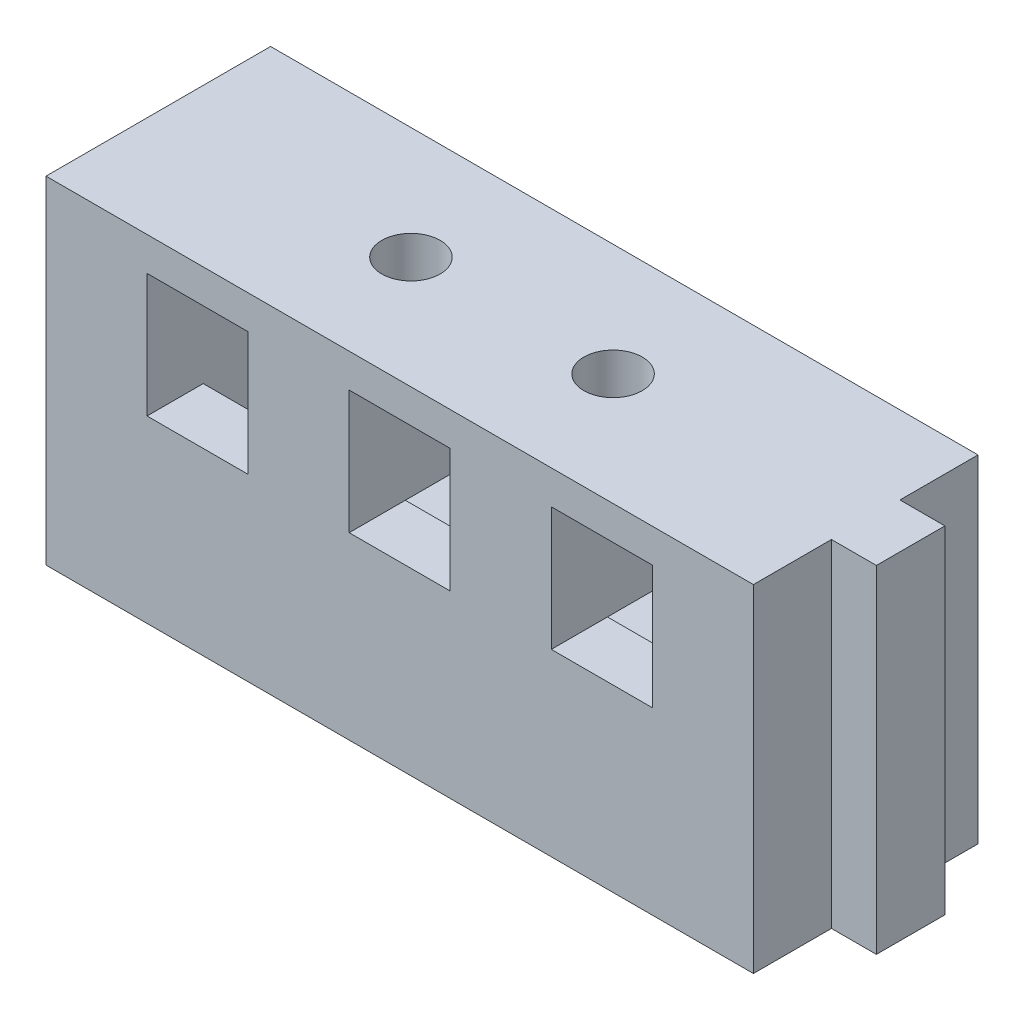
from build123d import *

# Parameters (mm, degrees)
SKETCH_1_W          = 63
SKETCH_1_H          = 30
SKETCH_1_W_2        = 9
SKETCH_1_H_2        = 11
EXTRUDE_2_DEPTH     = 20
SKETCH_2_W          = 9
SKETCH_2_H          = 11
CUT_EXTRUDE_1_DEPTH = 15
SKETCH_3_W          = 9
SKETCH_3_H          = 11
EXTRUDE_3_DEPTH     = 15
CUT_EXTRUDE_2_DEPTH = 100
SKETCH_6_R          = 5
CUT_EXTRUDE_3_DEPTH = 2
SKETCH_7_W          = 3.05
SKETCH_7_H          = 15
EXTRUDE_4_DEPTH     = 4


with BuildPart() as part:
    # 草图1 → 凸台-拉伸2 (new body)
    with BuildSketch(Plane.XY):
        with Locations((18.5, 15)):
            Rectangle(SKETCH_1_W, SKETCH_1_H)
        with Locations((18.5, 21.5)):
            Rectangle(SKETCH_1_W_2, SKETCH_1_H_2, mode=Mode.SUBTRACT)
        with Locations((36.5, 21.5)):
            Rectangle(SKETCH_1_W_2, SKETCH_1_H_2, mode=Mode.SUBTRACT)
        with Locations((0.5, 21.5)):
            Rectangle(SKETCH_1_W_2, SKETCH_1_H_2, mode=Mode.SUBTRACT)
    extrude(amount=EXTRUDE_2_DEPTH)

    # 草图2 → 切除-拉伸1 (cut)
    with BuildSketch(Plane(origin=(0, 0, 0), x_dir=(-1, 0, 0), z_dir=(0, 0, -1))):
        Polygon((-50, 16), (-50, 5), (4, 5), (4, 16), (-5, 16), (-14, 16), (-23, 16), (-32, 16), (-41, 16), align=None)
        with Locations((8.5, 10.5)):
            Rectangle(SKETCH_2_W, SKETCH_2_H)
    extrude(amount=-CUT_EXTRUDE_1_DEPTH, mode=Mode.SUBTRACT)

    # 草图3 → 凸台-拉伸3 (add)
    with BuildSketch(Plane(origin=(0, 0, 0), x_dir=(-1, 0, 0), z_dir=(0, 0, -1))):
        with Locations((-45.5, 10.5)):
            Rectangle(SKETCH_3_W, SKETCH_3_H)
        with Locations((8.5, 10.5)):
            Rectangle(SKETCH_3_W, SKETCH_3_H)
    extrude(amount=-EXTRUDE_3_DEPTH)

    # 草图5 → 切除-拉伸2 (cut)
    with BuildSketch(Plane.XZ):
        with BuildLine():
            ThreePointArc((27.5, 12.6), (25.661522369, 11.838477631), (24.9, 10))
            Line((24.9, 10), (27.5, 10))
            Line((27.5, 10), (27.5, 12.6))
        make_face()
        with BuildLine():
            Line((27.5, 10), (24.9, 10))
            ThreePointArc((24.9, 10), (25.661522369, 8.161522369), (27.5, 7.4))
            Line((27.5, 7.4), (27.5, 10))
        make_face()
        with BuildLine():
            Line((30.1, 10), (27.5, 10))
            Line((27.5, 10), (27.5, 7.4))
            ThreePointArc((27.5, 7.4), (29.338477631, 8.161522369), (30.1, 10))
        make_face()
        with BuildLine():
            Line((27.5, 12.6), (27.5, 10))
            Line((27.5, 10), (30.1, 10))
            ThreePointArc((30.1, 10), (29.338477631, 11.838477631), (27.5, 12.6))
        make_face()
        with BuildLine():
            Line((9.5, 10), (9.5, 7.4))
            ThreePointArc((9.5, 7.4), (11.338477631, 8.161522369), (12.1, 10))
            Line((12.1, 10), (9.5, 10))
        make_face()
        with BuildLine():
            Line((9.5, 12.6), (9.5, 10))
            Line((9.5, 10), (12.1, 10))
            ThreePointArc((12.1, 10), (11.338477631, 11.838477631), (9.5, 12.6))
        make_face()
        with BuildLine():
            ThreePointArc((6.9, 10), (7.661522369, 8.161522369), (9.5, 7.4))
            Line((9.5, 7.4), (9.5, 10))
            Line((9.5, 10), (6.9, 10))
        make_face()
        with BuildLine():
            Line((6.9, 10), (9.5, 10))
            Line((9.5, 10), (9.5, 12.6))
            ThreePointArc((9.5, 12.6), (7.661522369, 11.838477631), (6.9, 10))
        make_face()
    extrude(amount=-CUT_EXTRUDE_2_DEPTH, mode=Mode.SUBTRACT)

    # 草图6 → 切除-拉伸3 (cut)
    with BuildSketch(Plane(origin=(0, 5, 0), x_dir=(1, 0, 0), z_dir=(0, 1, 0))):
        with Locations(Location((9.5, -10, 0), (0, 0, 270))):
            Circle(SKETCH_6_R)
        with Locations(Location((27.5, -10, 0), (0, 0, 270))):
            Circle(SKETCH_6_R)
    extrude(amount=-CUT_EXTRUDE_3_DEPTH, mode=Mode.SUBTRACT)

    # 草图7 → 凸台-拉伸4 (add)
    with BuildSketch(Plane(origin=(50, 0, 0), x_dir=(0, 0, -1), z_dir=(1, 0, 0))):
        with Locations((-8.475, 22.5)):
            Rectangle(SKETCH_7_W, SKETCH_7_H)
        with Locations((-11.525, 22.5)):
            Rectangle(SKETCH_7_W, SKETCH_7_H)
        with Locations((-11.525, 7.5)):
            Rectangle(SKETCH_7_W, SKETCH_7_H)
        with Locations((-8.475, 7.5)):
            Rectangle(SKETCH_7_W, SKETCH_7_H)
    extrude(amount=EXTRUDE_4_DEPTH)


solid = part.part
